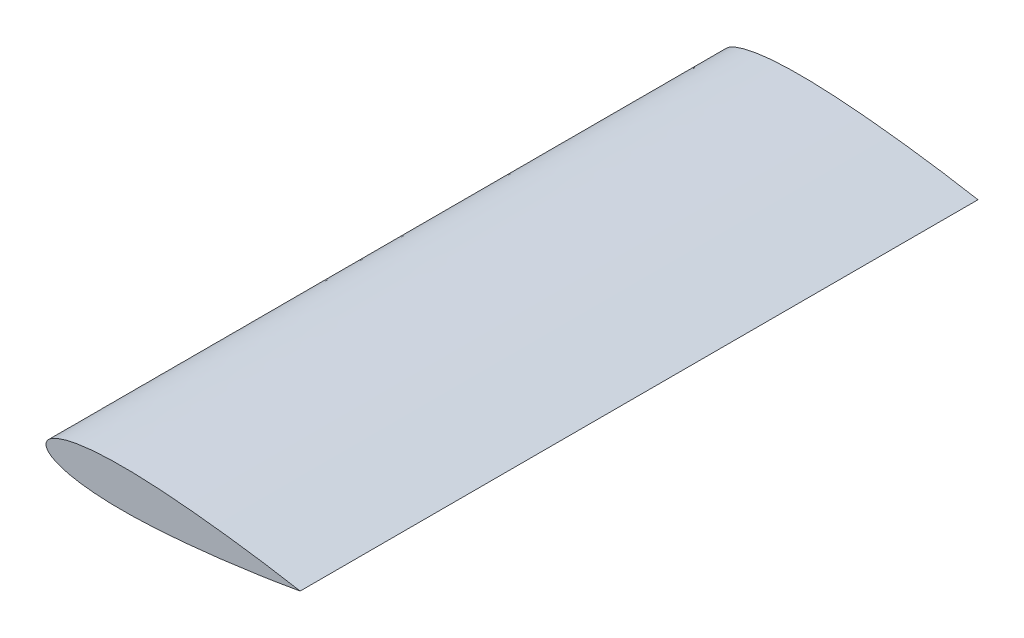
from build123d import *

# Parameters (mm, degrees)
EXTRUDE_1_DEPTH = 800


with BuildPart() as part:
    # 草图2 → 凸台-拉伸1 (new body)
    with BuildSketch(Plane.XY):
        with BuildLine():
            add(Edge.make_bspline(
                [(0, 0), (-9.5489e-05, -0.326407864), (0.030950281, -0.854000019), (0.150423202, -1.616777315), (0.448674258, -2.608935021), (0.848421592, -3.530047693), (1.433806351, -4.534449955), (2.263610744, -5.639668731), (3.456837907, -6.896675246), (5.225908513, -8.375867947), (7.906613431, -10.141837985), (11.989896233, -12.22562949), (18.321708513, -14.665606049), (27.826133031, -17.300188207), (41.974112353, -19.921000387), (60.222043604, -21.810463358), (78.624134319, -22.552186027), (95.988954389, -22.549739294), (113.345884106, -22.102249143), (130.689546496, -21.271088382), (148.01027967, -20.054961298), (165.306340091, -18.538013572), (179.703344131, -17.102052063), (191.21103146, -15.859228418), (201.272024493, -14.695659938), (209.889114389, -13.64726737), (217.06675899, -12.740467847), (222.804921516, -11.995811085), (229.977619163, -11.040364781), (238.573919489, -9.856643655), (248.605455284, -8.418167008), (258.611446595, -6.914785611), (267.201727162, -5.572315852), (274.322933639, -4.424865398), (280.072746677, -3.475406948), (285.700780324, -2.525508132), (290.829335304, -1.636879112), (294.873159607, -0.924080287), (298.04592284, -0.353968123), (299.35238804, -0.117662998), (300.000000001, 0)],
                knots=[0, 0, 0, 0, 0, 0.003840944, 0.006235023, 0.009072291, 0.01219322, 0.015656839, 0.019917177, 0.025338962, 0.032592504, 0.042799388, 0.05770457, 0.079310668, 0.112503101, 0.158972616, 0.227236465, 0.295500326, 0.329632258, 0.36376419, 0.432028053, 0.500291915, 0.534423847, 0.56855578, 0.602687711, 0.636819643, 0.653885609, 0.670951575, 0.688017542, 0.705083508, 0.739215439, 0.773347371, 0.807479302, 0.824545268, 0.841611234, 0.8586772, 0.875743167, 0.892809133, 0.901342117, 0.9098751, 0.9098751, 0.9098751, 0.9098751, 0.9098751], degree=4))
            add(Edge.make_bspline(
                [(0, 0), (-9.5489e-05, 0.326407864), (0.030950281, 0.854000019), (0.150423202, 1.616777315), (0.448674258, 2.608935021), (0.848421592, 3.530047693), (1.433806351, 4.534449955), (2.263610744, 5.639668731), (3.456837907, 6.896675246), (5.225908513, 8.375867947), (7.906613431, 10.141837985), (11.989896233, 12.22562949), (18.321708513, 14.665606049), (27.826133031, 17.300188207), (41.974112353, 19.921000387), (60.222043604, 21.810463358), (78.624134319, 22.552186027), (95.988954389, 22.549739295), (113.345884106, 22.102249143), (130.689546496, 21.271088382), (148.01027967, 20.054961298), (165.306340091, 18.538013572), (179.703344131, 17.102052063), (191.21103146, 15.859228418), (201.272024493, 14.695659938), (209.889114389, 13.64726737), (217.06675899, 12.740467847), (222.804921516, 11.995811086), (229.977619163, 11.040364781), (238.573919489, 9.856643655), (248.605455284, 8.418167009), (258.611446595, 6.914785611), (267.201727162, 5.572315852), (274.322933639, 4.424865398), (280.072746677, 3.475406948), (285.700780324, 2.525508132), (290.829335304, 1.636879112), (294.873159607, 0.924080288), (298.04592284, 0.353968123), (299.35238804, 0.117662998), (300.000000001, 0)],
                knots=[0, 0, 0, 0, 0, 0.003840944, 0.006235023, 0.009072291, 0.01219322, 0.015656839, 0.019917177, 0.025338962, 0.032592504, 0.042799388, 0.05770457, 0.079310668, 0.112503101, 0.158972616, 0.227236465, 0.295500326, 0.329632258, 0.36376419, 0.432028053, 0.500291915, 0.534423847, 0.56855578, 0.602687711, 0.636819643, 0.653885609, 0.670951575, 0.688017542, 0.705083508, 0.739215439, 0.773347371, 0.807479302, 0.824545268, 0.841611234, 0.8586772, 0.875743167, 0.892809133, 0.901342117, 0.9098751, 0.9098751, 0.9098751, 0.9098751, 0.9098751], degree=4))
        make_face()
    extrude(amount=EXTRUDE_1_DEPTH)


solid = part.part
